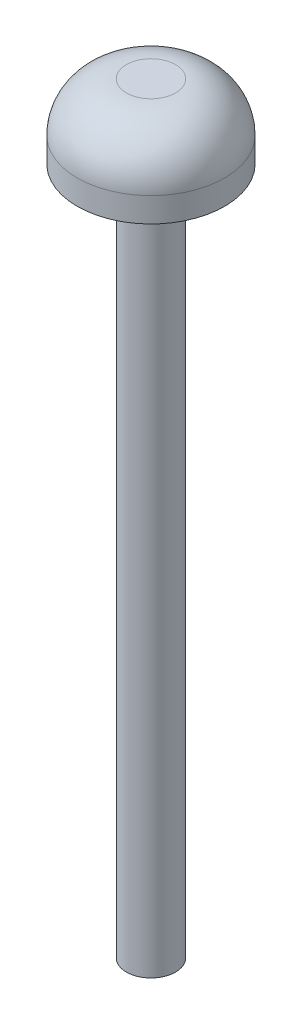
from build123d import *

# Parameters (mm, degrees)
SKETCH2_R           = 0.5
BOSS_EXTRUDE1_DEPTH = 14
SKETCH3_R           = 1.5
BOSS_EXTRUDE2_DEPTH = 1.5
FILLET1_R           = 1


with BuildPart() as part:
    # Sketch2 → Boss-Extrude1 (new body)
    with BuildSketch(Plane(origin=(0, 0, 0), x_dir=(1, 0, 0), z_dir=(0, 1, 0))):
        with Locations(Location((0, 0, 0), (0, 0, 270))):
            Circle(SKETCH2_R)
    extrude(amount=BOSS_EXTRUDE1_DEPTH)

    # Sketch3 → Boss-Extrude2 (add)
    with BuildSketch(Plane(origin=(0, 14, 0), x_dir=(1, 0, 0), z_dir=(0, 1, 0))):
        with Locations(Location((0, 0, 0), (0, 0, 270))):
            Circle(SKETCH3_R)
    extrude(amount=BOSS_EXTRUDE2_DEPTH)

    # Fillet1
    fillet1_edges = [part.edges().sort_by_distance(p)[0] for p in [
        (0, 15.5, -1.5),
    ]]
    fillet(fillet1_edges, radius=FILLET1_R)


solid = part.part
